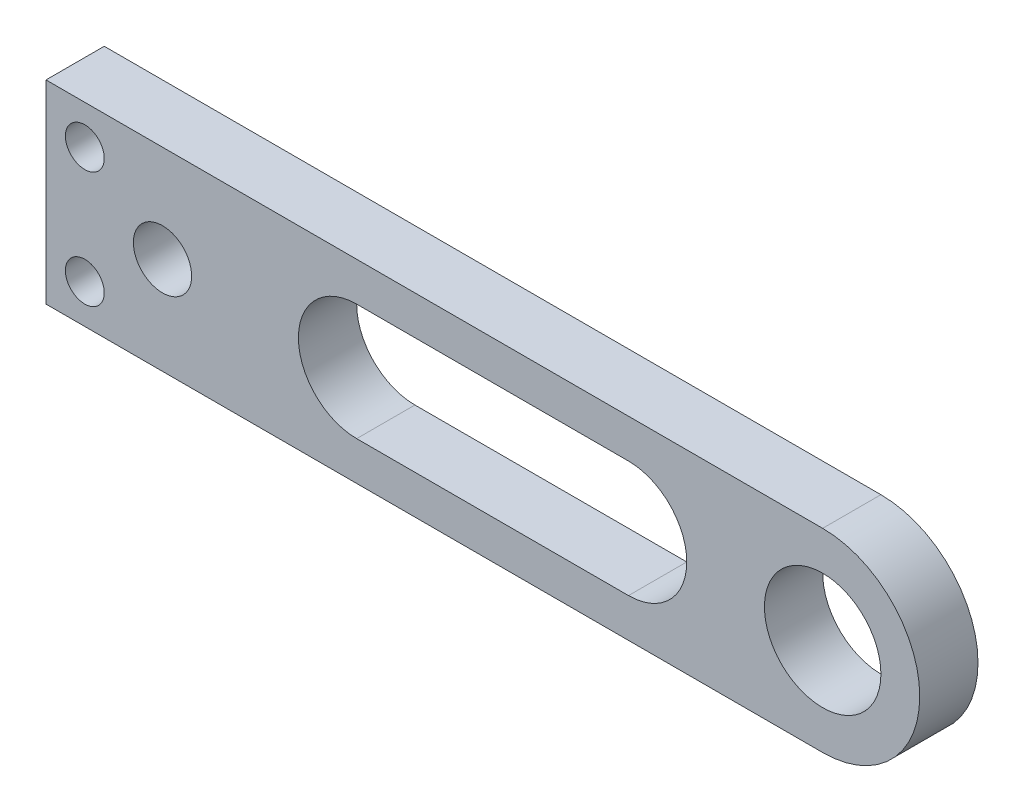
from build123d import *

# Parameters (mm, degrees)
SKETCH_2_R      = 1
SKETCH_2_R_2    = 1.5
SKETCH_2_R_3    = 3
EXTRUDE_1_DEPTH = 3


with BuildPart() as part:
    # 草图2 → 凸台-拉伸1 (new body)
    with BuildSketch(Plane.XY):
        with BuildLine():
            Line((0, 5), (34, 5))
            ThreePointArc((34, 5), (39, 0), (34, -5))
            Line((34, -5), (0, -5))
            Line((0, -5), (-6, -5))
            Line((-6, -5), (-6, 5))
            Line((-6, 5), (0, 5))
        make_face()
        with Locations((-4, 3)):
            Circle(SKETCH_2_R, mode=Mode.SUBTRACT)
        Circle(SKETCH_2_R_2, mode=Mode.SUBTRACT)
        with Locations((34, 0)):
            Circle(SKETCH_2_R_3, mode=Mode.SUBTRACT)
        with Locations((-4, -3)):
            Circle(SKETCH_2_R, mode=Mode.SUBTRACT)
        with BuildLine():
            Line((10, 3), (24, 3))
            ThreePointArc((24, 3), (27, 0), (24, -3))
            Line((24, -3), (10, -3))
            ThreePointArc((10, -3), (7, 0), (10, 3))
        make_face(mode=Mode.SUBTRACT)
    extrude(amount=EXTRUDE_1_DEPTH)


solid = part.part
